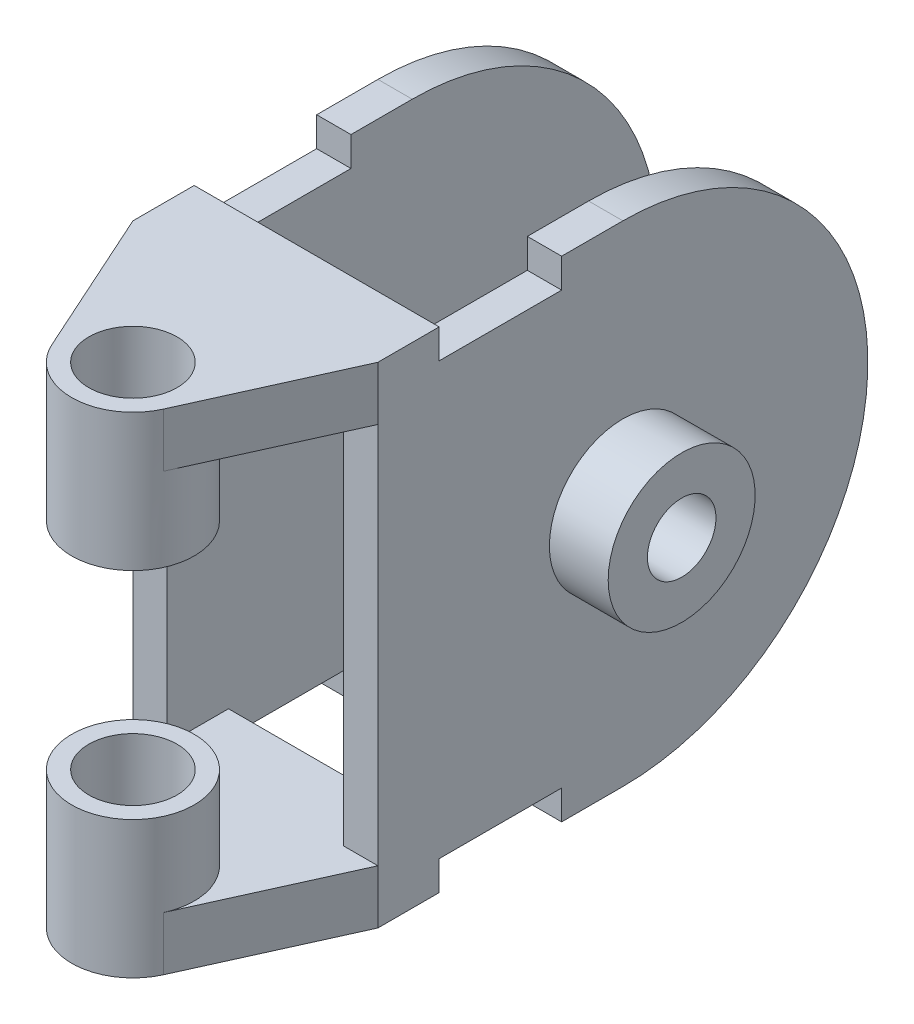
from build123d import *

# Parameters (mm, degrees)
BOSS_EXTRUDE1_START = 18
BOSS_EXTRUDE1_DEPTH = 7
BOSS_EXTRUDE3_START = -18
BOSS_EXTRUDE3_DEPTH = 7
BOSS_EXTRUDE4_DEPTH = 11
BOSS_EXTRUDE5_START = -11
BOSS_EXTRUDE5_DEPTH = 11
SKETCH9_R           = 12.5
BOSS_EXTRUDE6_DEPTH = 28
BOSS_EXTRUDE7_START = -28
SKETCH11_R          = 12.5
BOSS_EXTRUDE7_DEPTH = 28
HOLE1_D             = 18
SKETCH14_R          = 15
BOSS_EXTRUDE8_DEPTH = 12
HOLE2_D             = 14


with BuildPart() as part:
    # Sketch1 → Boss-Extrude1 (new body)
    with BuildSketch(Plane(origin=(0, 0, 0), x_dir=(0, 0, -1), z_dir=(1, 0, 0)).offset(BOSS_EXTRUDE1_START)):
        with BuildLine():
            Line((0, 0), (12.5, 0))
            Line((12.5, 0), (12.5, 6))
            Line((12.5, 6), (37.5, 6))
            Line((37.5, 6), (37.5, 0))
            Line((37.5, 0), (50, 0))
            ThreePointArc((50, 0), (100, 50), (50, 100))
            Line((50, 100), (37.5, 100))
            Line((37.5, 100), (37.5, 94))
            Line((37.5, 94), (12.5, 94))
            Line((12.5, 94), (12.5, 100))
            Line((12.5, 100), (0, 100))
            Line((0, 100), (0, 0))
        make_face()
    extrude(amount=BOSS_EXTRUDE1_DEPTH)



with BuildPart() as body_2:
    # Sketch3 → Boss-Extrude3 (new body)
    with BuildSketch(Plane(origin=(0, 0, 0), x_dir=(0, 0, -1), z_dir=(1, 0, 0)).offset(BOSS_EXTRUDE3_START)):
        with BuildLine():
            Line((0, 100), (0, 0))
            Line((0, 0), (12.5, 0))
            Line((12.5, 0), (12.5, 6))
            Line((12.5, 6), (37.5, 6))
            Line((37.5, 6), (37.5, 0))
            Line((37.5, 0), (50, 0))
            ThreePointArc((50, 0), (100, 50), (50, 100))
            Line((50, 100), (37.5, 100))
            Line((37.5, 100), (37.5, 94))
            Line((37.5, 94), (12.5, 94))
            Line((12.5, 94), (12.5, 100))
            Line((12.5, 100), (0, 100))
        make_face()
    extrude(amount=-BOSS_EXTRUDE3_DEPTH)


with BuildPart() as part_1:
    add(part.part)

    add(body_2.part)  # Boss-Extrude4 merges body 2
    # Sketch5 → Boss-Extrude4 (add)
    with BuildSketch(Plane(origin=(0, 100, 0), x_dir=(1, 0, 0), z_dir=(0, 1, 0))):
        with BuildLine():
            Line((-25, 12.5), (25, 12.5))
            Line((25, 12.5), (25, 0))
            Line((25, 0), (11.392973, -30.142973))
            ThreePointArc((11.392973, -30.142973), (0, -37.5), (-11.392973, -30.142973))
            Line((-11.392973, -30.142973), (-25, 0))
            Line((-25, 0), (-25, 12.5))
        make_face()
    extrude(amount=-BOSS_EXTRUDE4_DEPTH)

    # Sketch8 → Boss-Extrude5 (add)
    with BuildSketch(Plane.XZ.offset(BOSS_EXTRUDE5_START)):
        with BuildLine():
            Line((-25, 0), (-25, -12.5))
            Line((-25, -12.5), (-18, -12.5))
            Line((-18, -12.5), (18, -12.5))
            Line((18, -12.5), (25, -12.5))
            Line((25, -12.5), (25, 0))
            Line((25, 0), (11.392973, 30.142973))
            ThreePointArc((11.392973, 30.142973), (0, 37.5), (-11.392973, 30.142973))
            Line((-11.392973, 30.142973), (-25, 0))
        make_face()
    extrude(amount=BOSS_EXTRUDE5_DEPTH)

    # Sketch9 → Boss-Extrude6 (add)
    with BuildSketch(Plane(origin=(0, 100, 0), x_dir=(1, 0, 0), z_dir=(0, 1, 0))):
        with Locations(Location((0, -25, 0), (0, 0, 270))):
            Circle(SKETCH9_R)
    extrude(amount=-BOSS_EXTRUDE6_DEPTH)

    # Sketch11 → Boss-Extrude7 (add)
    with BuildSketch(Plane.XZ.offset(BOSS_EXTRUDE7_START)):
        with Locations(Location((0, 25, 0), (0, 0, 90))):
            Circle(SKETCH11_R)
    extrude(amount=BOSS_EXTRUDE7_DEPTH)

    # Hole1 (through all)
    with Locations(Plane(origin=(0, 0, 0), x_dir=(-1, 0, 0), z_dir=(0, -1, 0))):
        with Locations((0, -25)):
            Hole(HOLE1_D / 2)

    # Sketch14 → Boss-Extrude8 (add)
    with BuildSketch(Plane.ZY.offset(25)):
        with Locations((-50, 50)):
            Circle(SKETCH14_R)
    boss_extrude8 = extrude(amount=BOSS_EXTRUDE8_DEPTH)

    # Mirror1: Boss-Extrude8 across plane
    add(boss_extrude8.mirror(Plane(origin=(0, 0, 0), x_dir=(0, 0, 1), z_dir=(1, 0, 0))))

    # Hole2 (through all)
    with Locations(Plane(origin=(37, 0, 0), x_dir=(0, 0, -1), z_dir=(1, 0, 0))):
        with Locations((50, 50)):
            Hole(HOLE2_D / 2)


solid = part_1.part
